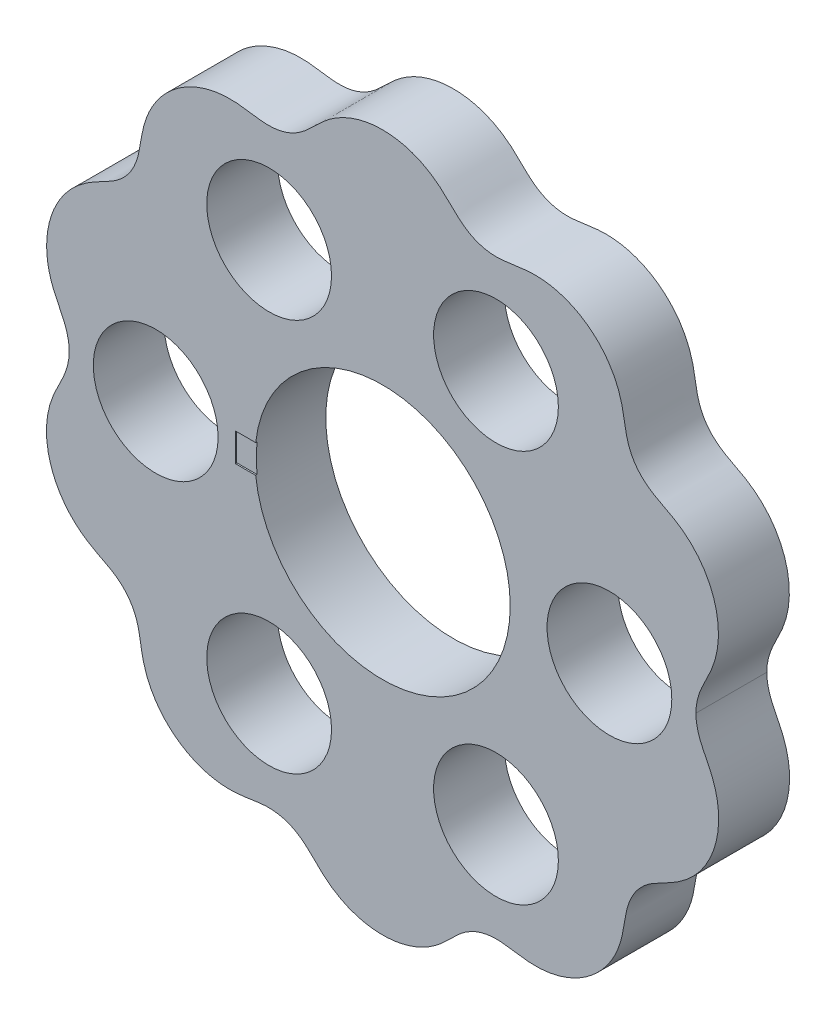
from build123d import *

# Parameters (mm, degrees)
SKETCH2_R           = 9.0043
SKETCH2_R_2         = 4.4
BOSS_EXTRUDE1_DEPTH = 5
CUT_EXTRUDE1_DEPTH  = 0.1


with BuildPart() as part:
    # Sketch2 → Boss-Extrude1 (new body)
    with BuildSketch(Plane.XY.offset(5.605325797)):
        with BuildLine():
            add(Edge.make_bspline(
                [(22.1, 0), (22.1, -0.029302567), (22.100656996, -0.073267299), (22.102846978, -0.150479345), (22.107765032, -0.243024679), (22.113002169, -0.31356521), (22.121167512, -0.399042775), (22.137660505, -0.535547313), (22.168477812, -0.725309174), (22.221962498, -0.961733919), (22.301132136, -1.228529968), (22.396248759, -1.489311546), (22.504572502, -1.745256299), (22.622714563, -1.996489409), (22.746713886, -2.245018567), (22.87241041, -2.492573124), (22.995858066, -2.741341347), (23.143387346, -3.055544856), (23.304631036, -3.439826563), (23.489677504, -3.978553819), (23.651034334, -4.683442393), (23.730085815, -5.486733771), (23.690072978, -6.376338564), (23.526656928, -7.245430382), (23.246859664, -8.078377589), (22.858354421, -8.859291128), (22.36991344, -9.575757168), (21.746771046, -10.259536929), (20.979757182, -10.880170438), (20.07185269, -11.393514988), (19.074956387, -11.857034761), (18.181387307, -12.525379462), (17.522574849, -13.435236027), (17.165903162, -14.499100143), (17.035166981, -15.602135191), (16.773131617, -16.850230243), (16.183180557, -18.169843003), (15.185324779, -19.426415814), (13.758890787, -20.45679901), (12.257817896, -21.009294245), (10.828993799, -21.15920723), (9.560643085, -21.020485338), (8.461027709, -20.802084394), (7.328375606, -20.821045963), (6.253101017, -21.181361325), (5.341855753, -21.842454293), (4.590177093, -22.657661818), (3.646274458, -23.503590974), (2.404327803, -24.212967426), (0.872596385, -24.63896937), (-0.872596249, -24.638969598), (-2.404328196, -24.212967156), (-3.646273705, -23.503591358), (-4.590178654, -22.657661122), (-5.341852785, -21.84245556), (-6.253105576, -21.1813594), (-7.328368243, -20.821049059), (-8.46104013, -20.80207918), (-9.560620352, -21.020494874), (-10.829032369, -21.159191057), (-12.257759872, -21.009318559), (-13.741024473, -20.463370436), (-15.139383208, -19.4615155), (-16.041258918, -18.353410382), (-16.553530054, -17.344966352), (-16.819283882, -16.538402702), (-16.951869323, -15.981061926), (-17.071894903, -15.275534032), (-17.175369193, -14.567994024), (-17.371218875, -13.874397941), (-17.759814305, -13.10553406), (-18.30130832, -12.427799863), (-19.120124546, -11.828042716), (-20.161840701, -11.354111243), (-21.266581229, -10.70199441), (-22.310551276, -9.733982335), (-23.165156921, -8.427533899), (-23.625552587, -7.017417615), (-23.746197848, -5.757684391), (-23.663442889, -4.777094196), (-23.518570066, -4.085486246), (-23.321955401, -3.476877841), (-23.100306653, -2.948620034), (-22.84529241, -2.436105267), (-22.615965168, -1.990999888), (-22.408917504, -1.534577596), (-22.277167112, -1.163364664), (-22.202479171, -0.886606409), (-22.154838808, -0.640885487), (-22.13560223, -0.516552839), (-22.122473754, -0.410978079), (-22.113805721, -0.322921864), (-22.10824541, -0.250610924), (-22.104067745, -0.17471333), (-22.1012791, -0.097385476), (-22.100232564, -0.045489039), (-22.1, -0.015098244), (-22.1, 0)],
                knots=[0.07789061, 0.07789061, 0.07789061, 0.07789061, 0.07789061, 0.079370354, 0.080110226, 0.080850098, 0.08158997, 0.082329842, 0.083809586, 0.086769074, 0.089728562, 0.09268805, 0.095647538, 0.098607026, 0.101566514, 0.104526002, 0.10748549, 0.110444978, 0.113404466, 0.119323442, 0.125242418, 0.134700775, 0.144159132, 0.15361749, 0.163075847, 0.172283742, 0.181491636, 0.190699531, 0.199907426, 0.211620029, 0.223332633, 0.235045236, 0.24675784, 0.258595752, 0.270433664, 0.282271576, 0.294109487, 0.312775713, 0.331441938, 0.349816075, 0.368190212, 0.380135666, 0.392081119, 0.404026572, 0.415972026, 0.427791948, 0.43961187, 0.451431791, 0.463251713, 0.481625819, 0.499999926, 0.518374032, 0.536748138, 0.54856806, 0.560387982, 0.572207904, 0.584027825, 0.595973279, 0.607918732, 0.619864186, 0.631809639, 0.650183776, 0.668557913, 0.68641831, 0.704278706, 0.710378253, 0.716477801, 0.722577348, 0.728676896, 0.740875991, 0.746975538, 0.753075086, 0.765274168, 0.77747325, 0.789672332, 0.801871414, 0.819731822, 0.83759223, 0.855452636, 0.864382839, 0.873313042, 0.879412586, 0.885512129, 0.891611673, 0.897711216, 0.903810759, 0.906860531, 0.912960075, 0.91448496, 0.916009846, 0.917534732, 0.918297175, 0.919059618, 0.919822061, 0.920584504, 0.921346947, 0.92210939, 0.92210939, 0.92210939, 0.92210939, 0.92210939], degree=4))
            add(Edge.make_bspline(
                [(22.1, 0), (22.1, 0.014913522), (22.100226653, 0.044933173), (22.10124659, 0.096082665), (22.103964371, 0.172403639), (22.1080359, 0.247492105), (22.113454992, 0.319065267), (22.121902979, 0.406124587), (22.134698422, 0.510371309), (22.153447855, 0.633233839), (22.179982074, 0.772060815), (22.211452218, 0.909853003), (22.247651008, 1.046536238), (22.288329804, 1.181935635), (22.344427346, 1.349509412), (22.419456754, 1.547897543), (22.516663816, 1.77543969), (22.667370853, 2.095152506), (22.858985392, 2.473433664), (23.078460642, 2.916931322), (23.297969399, 3.438594817), (23.496579982, 4.046049559), (23.64564957, 4.743090599), (23.714142725, 5.526673223), (23.670851556, 6.385255045), (23.512632324, 7.226073234), (23.245004777, 8.034719064), (22.874344583, 8.796894529), (22.407796336, 9.500388465), (21.802810765, 10.188284793), (21.043808682, 10.825622856), (20.128343518, 11.363955359), (19.101585771, 11.838846865), (18.181239937, 12.520028998), (17.50891279, 13.454995968), (17.155819834, 14.543847375), (17.02328672, 15.666811584), (16.740047931, 16.912966571), (16.138001231, 18.207755715), (15.152648058, 19.425448044), (13.945498817, 20.298310592), (12.783576336, 20.798139903), (11.690887772, 21.051994172), (10.698758715, 21.128491931), (9.629805955, 21.030482528), (8.50287965, 20.804890253), (7.342467075, 20.814718589), (6.238109955, 21.184768886), (5.31001074, 21.869680724), (4.539808437, 22.705915037), (3.576098101, 23.539359516), (2.337850697, 24.219609627), (0.840864936, 24.619297162), (-0.840864954, 24.619297154), (-2.337850638, 24.219609637), (-3.576098219, 23.539359501), (-4.539808186, 22.705915064), (-5.310011212, 21.869680677), (-6.238109236, 21.184768958), (-7.342468241, 20.814718473), (-8.502877632, 20.804890453), (-9.629809926, 21.030482133), (-10.698752375, 21.128492562), (-11.690895606, 21.051993386), (-12.783563324, 20.798141241), (-13.939824249, 20.30075947), (-15.137709214, 19.436881183), (-16.121598679, 18.230667487), (-16.728655439, 16.945369314), (-17.019832961, 15.697447108), (-17.151654869, 14.561988282), (-17.504447964, 13.459997777), (-18.184591746, 12.514224003), (-19.117520125, 11.829007906), (-20.156413449, 11.351465046), (-21.256719581, 10.695581158), (-22.297277306, 9.726765243), (-23.149255071, 8.421124942), (-23.60910939, 7.012995514), (-23.730598606, 5.75499692), (-23.649636571, 4.775573938), (-23.506579637, 4.08451009), (-23.312164543, 3.476070063), (-23.120221717, 3.01371781), (-22.935057566, 2.627018443), (-22.774924406, 2.307695536), (-22.647373706, 2.051947916), (-22.509566084, 1.761427705), (-22.398099841, 1.498124207), (-22.313048098, 1.26278764), (-22.25078913, 1.057652616), (-22.213840712, 0.919575427), (-22.181707778, 0.780344568), (-22.154607389, 0.640086531), (-22.135453799, 0.515905115), (-22.122380878, 0.410461871), (-22.113749008, 0.322515453), (-22.108211682, 0.250292312), (-22.104051158, 0.174484331), (-22.101273896, 0.097249104), (-22.100231618, 0.045422996), (-22.1, 0.015075963), (-22.1, 0)],
                knots=[0.077977028, 0.077977028, 0.077977028, 0.077977028, 0.077977028, 0.078731103, 0.079485177, 0.080239252, 0.080993326, 0.0817474, 0.082501475, 0.084009624, 0.085517772, 0.087025921, 0.08853407, 0.090042219, 0.091550368, 0.093058516, 0.096074814, 0.099091112, 0.102107409, 0.108140005, 0.1141726, 0.120205195, 0.12623779, 0.135381073, 0.144524356, 0.153667639, 0.162810921, 0.171787395, 0.180763869, 0.189740343, 0.198716817, 0.21078185, 0.222846882, 0.234911915, 0.246976948, 0.259042056, 0.271107164, 0.283172272, 0.295237381, 0.313357051, 0.331476722, 0.349220208, 0.358091952, 0.366963695, 0.379220116, 0.391476537, 0.403732958, 0.415989379, 0.428120336, 0.440251292, 0.452382248, 0.464513204, 0.482256584, 0.499999964, 0.517743344, 0.535486724, 0.54761768, 0.559748636, 0.571879592, 0.584010548, 0.596266969, 0.60852339, 0.620779811, 0.633036233, 0.641907976, 0.650779719, 0.668523206, 0.686379934, 0.704236662, 0.716433282, 0.728629901, 0.740826521, 0.753023141, 0.765219739, 0.777416337, 0.789612935, 0.801809534, 0.819666292, 0.837523049, 0.855379796, 0.864308169, 0.873236542, 0.879334846, 0.885433149, 0.891531453, 0.894580605, 0.897629757, 0.900678909, 0.903728061, 0.908301788, 0.909826364, 0.91135094, 0.912875516, 0.914400092, 0.915924668, 0.917449244, 0.918211532, 0.91897382, 0.919736108, 0.920498396, 0.921260684, 0.922022972, 0.922022972, 0.922022972, 0.922022972, 0.922022972], degree=4))
        make_face()
        Circle(SKETCH2_R, mode=Mode.SUBTRACT)
        with Locations((8, 13.856406461)):
            Circle(SKETCH2_R_2, mode=Mode.SUBTRACT)
        with Locations((16, 0)):
            Circle(SKETCH2_R_2, mode=Mode.SUBTRACT)
        with Locations((8, -13.856406461)):
            Circle(SKETCH2_R_2, mode=Mode.SUBTRACT)
        with Locations((-8, -13.856406461)):
            Circle(SKETCH2_R_2, mode=Mode.SUBTRACT)
        with Locations((-16, 0)):
            Circle(SKETCH2_R_2, mode=Mode.SUBTRACT)
        with Locations((-8, 13.856406461)):
            Circle(SKETCH2_R_2, mode=Mode.SUBTRACT)
    extrude(amount=-BOSS_EXTRUDE1_DEPTH)

    # Sketch3 → Cut-Extrude1 (cut)
    with BuildSketch(Plane.XY.offset(5.605325797)):
        Polygon((-10.388759749, -1), (-10.388759749, 1), (-8.742920185, 1), (-8.663892273, 1), (-8.663892273, -1), align=None)
    extrude(amount=-CUT_EXTRUDE1_DEPTH, mode=Mode.SUBTRACT)


solid = part.part
